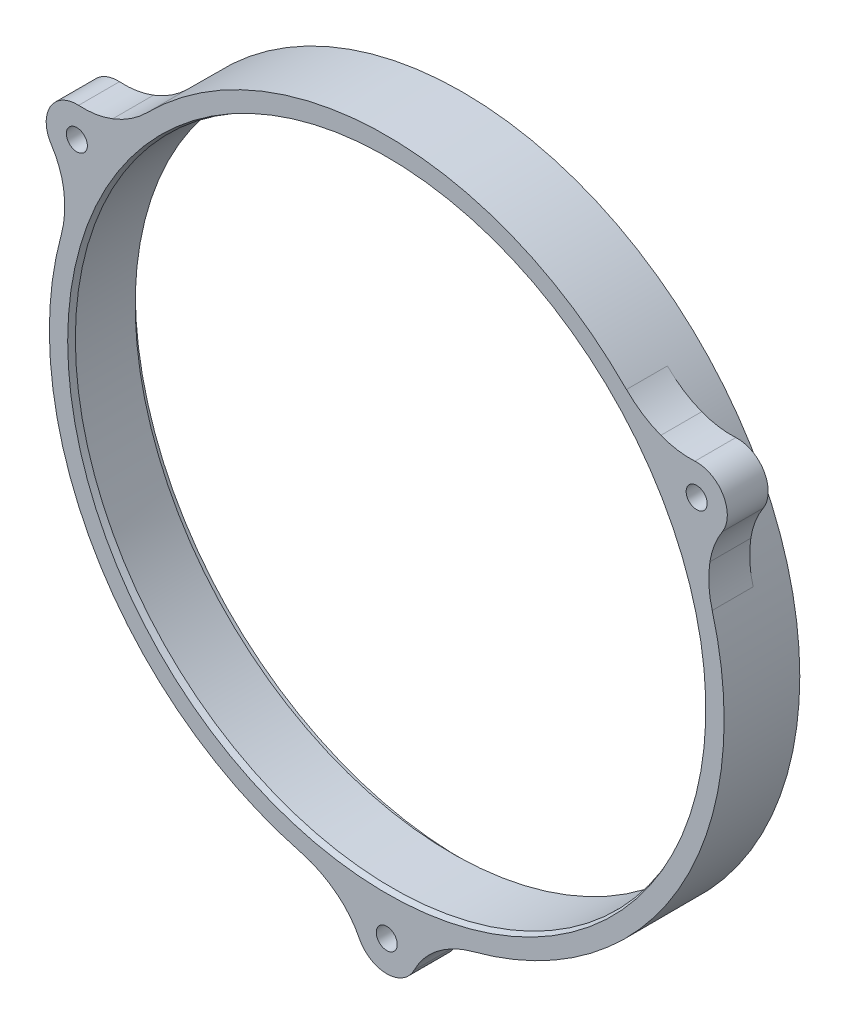
from build123d import *

# Parameters (mm, degrees)
BOSS_EXTRUDE2_START     = -12.7
BOSS_EXTRUDE2_DEPTH     = 12.7
F_1_4_CLEARANCE_HOLE1_D = 6.5278
CIRPATTERN3_COUNT       = 3
CHAMFER1_SIZE           = 0.635
CHAMFER1_SIZE2          = 1.744648161


with BuildPart() as part:
    # Sketch3 → Revolve1 (revolve)
    with BuildSketch(Plane(origin=(0, 0, 0), x_dir=(0, 0, -1), z_dir=(1, 0, 0)), mode=Mode.PRIVATE) as revolve1_sk:
        Polygon((0, 104.775), (23.495, 104.775), (23.495, 101.6), (20.32, 101.6), (20.32, 98.4504), (0, 98.4504), align=None)
    revolve(revolve1_sk.sketch.rotate(Axis((0, 0, 0), (0, 0, -1)), 90), axis=Axis((0, 0, 0), (0, 0, -1)))

    # Sketch8 → Boss-Extrude2 (add)
    with BuildSketch(Plane.XY.offset(BOSS_EXTRUDE2_START)):
        with BuildLine():
            ThreePointArc((-95.701964649, 65.072457101), (-104.485964967, 60.325), (-104.205383261, 50.344104028))
            ThreePointArc((-104.205383261, 50.344104028), (-101.748303649, 45.549235235), (-100.357835782, 40.343987299))
            ThreePointArc((-100.357835782, 40.343987299), (-100.041194467, 33.940544408), (-101.071009975, 27.612525556))
            ThreePointArc((-101.071009975, 27.612525556), (-90.737811682, 52.3875), (-74.448653582, 73.723799447))
            ThreePointArc((-74.448653582, 73.723799447), (-79.41397091, 69.667943629), (-85.117835782, 66.740441606))
            ThreePointArc((-85.117835782, 66.740441606), (-90.320946661, 65.341998135), (-95.701964649, 65.072457101))
        make_face()
    boss_extrude2 = extrude(amount=BOSS_EXTRUDE2_DEPTH)

    # 1/4 Clearance Hole1 (through all)
    with Locations(Plane(origin=(-78.9129789, -32.747864356, 0), x_dir=(1, 0, 0), z_dir=(0, 0, 1))):
        with Locations((-17.324094096, 88.310364356)):
            f_1_4_clearance_hole1 = Hole(F_1_4_CLEARANCE_HOLE1_D / 2)

    # CirPattern3: Boss-Extrude2, 1/4 Clearance Hole1 ×3 about axis
    cirpattern3_axis = Axis((0, 0, 0), (0, 0, 1))
    add([boss_extrude2.rotate(cirpattern3_axis, i * 360 / CIRPATTERN3_COUNT) for i in range(1, CIRPATTERN3_COUNT)])
    add([f_1_4_clearance_hole1.rotate(cirpattern3_axis, i * 360 / CIRPATTERN3_COUNT) for i in range(1, CIRPATTERN3_COUNT)], mode=Mode.SUBTRACT)

    # Chamfer1
    chamfer1_edges = [part.edges().sort_by_distance(p)[0] for p in [
        (-98.4504, 0, 0),
    ]]
    chamfer1_side = [part.faces().sort_by_distance(p)[0] for p in [
        (80.519485647, -62.098271917, 0),
    ]]
    chamfer(chamfer1_edges, length=CHAMFER1_SIZE, length2=CHAMFER1_SIZE2, reference=chamfer1_side[0])


solid = part.part
